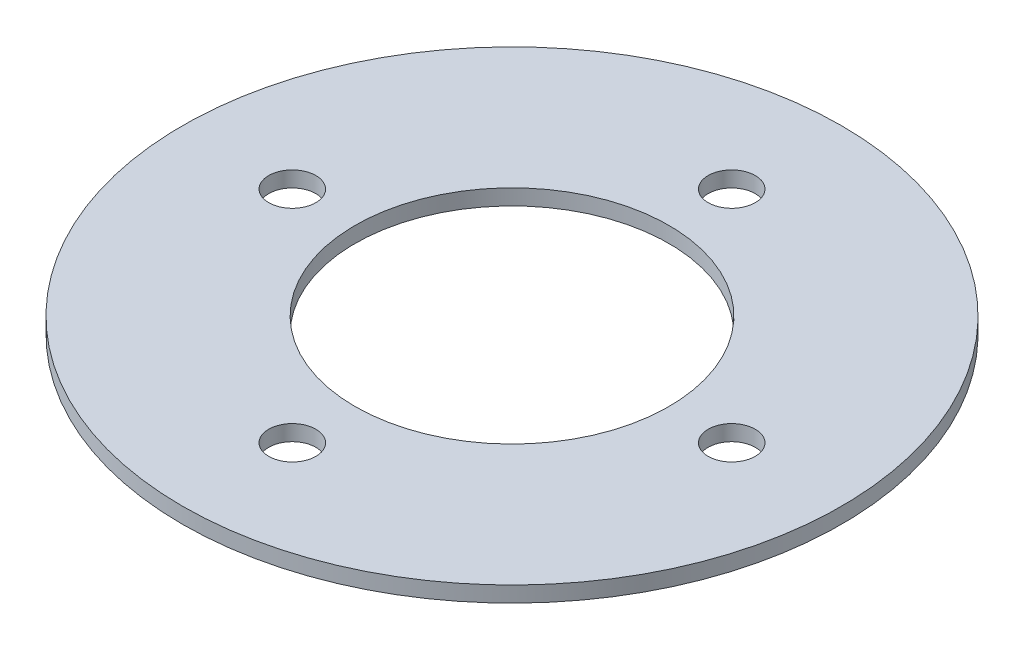
from build123d import *

# Parameters (mm, degrees)
SKETCH_1_R      = 21
SKETCH_1_R_2    = 1.5
SKETCH_1_R_3    = 10
EXTRUDE_2_DEPTH = 1


with BuildPart() as part:
    # 草图1 → 凸台-拉伸2 (new body)
    with BuildSketch(Plane(origin=(0, 0, 0), x_dir=(1, 0, 0), z_dir=(0, 1, 0))):
        with Locations(Location((0, 0, 0), (0, 0, 270))):
            Circle(SKETCH_1_R)
        with Locations(Location((0, 14, 0), (0, 0, 270))):
            Circle(SKETCH_1_R_2, mode=Mode.SUBTRACT)
        with Locations(Location((-14, 0, 0), (0, 0, 270))):
            Circle(SKETCH_1_R_2, mode=Mode.SUBTRACT)
        with Locations(Location((0, -14, 0), (0, 0, 270))):
            Circle(SKETCH_1_R_2, mode=Mode.SUBTRACT)
        with Locations(Location((14, 0, 0), (0, 0, 270))):
            Circle(SKETCH_1_R_2, mode=Mode.SUBTRACT)
        with Locations(Location((0, 0, 0), (0, 0, 270))):
            Circle(SKETCH_1_R_3, mode=Mode.SUBTRACT)
    extrude(amount=EXTRUDE_2_DEPTH)


solid = part.part
